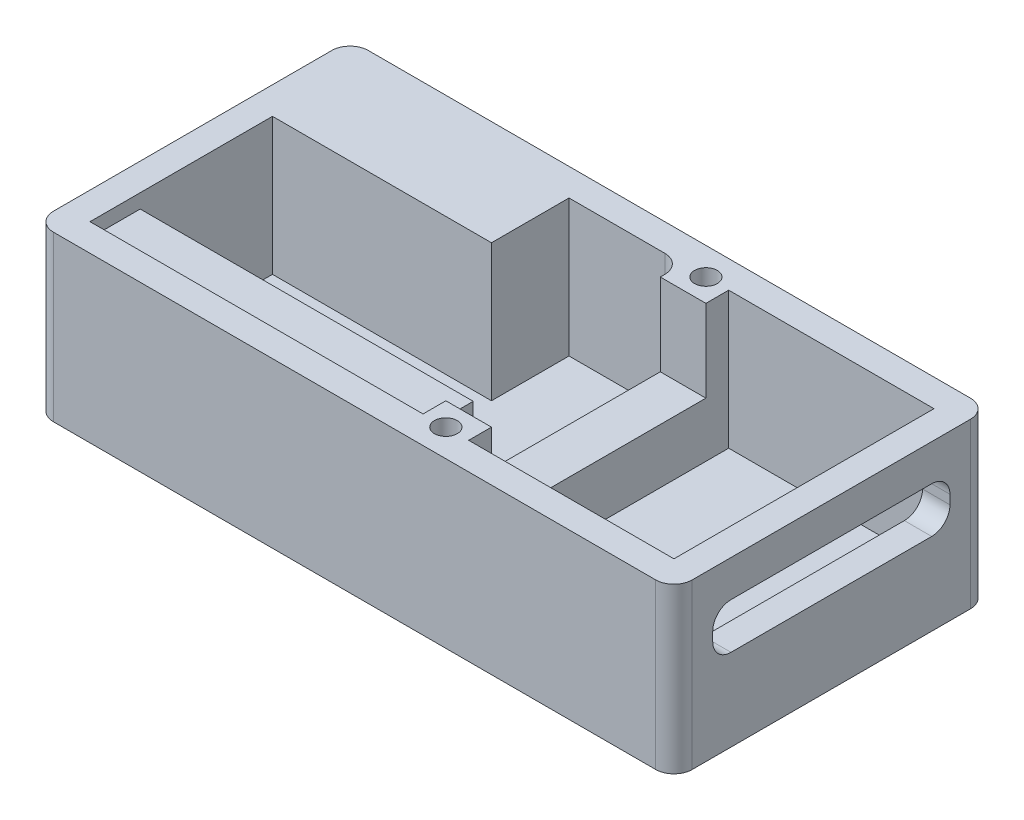
from build123d import *

# Parameters (mm, degrees)
SKETCH1_W           = 70
SKETCH1_H           = 34.5
BOSS_EXTRUDE1_DEPTH = 3
SKETCH2_W           = 70
SKETCH2_H           = 34.5
SKETCH2_W_2         = 64
SKETCH2_H_2         = 28.5
EXTRUDE_THIN1_DEPTH = 15
CUT_EXTRUDE1_REACH  = 76.307
SKETCH3_W           = 26
SKETCH3_H           = 5
SKETCH6_W           = 5
SKETCH6_H           = 28.5
BOSS_EXTRUDE2_DEPTH = 15
SKETCH7_W           = 24
SKETCH7_H           = 8.5
BOSS_EXTRUDE3_DEPTH = 15
SKETCH8_W           = 36.5
SKETCH8_H           = 5.5
BOSS_EXTRUDE4_DEPTH = 13.45
FILLET1_R           = 2
FILLET2_R           = 2
CUT_EXTRUDE6_REACH  = 44.972
SKETCH12_W          = 5
SKETCH12_H          = 23.5
SKETCH13_R          = 1.25
CUT_EXTRUDE7_DEPTH  = 10
FILLET4_R           = 2


with BuildPart() as part:
    # Sketch1 → Boss-Extrude1 (new body)
    with BuildSketch(Plane(origin=(0, 0, 0), x_dir=(1, 0, 0), z_dir=(0, 1, 0))):
        Rectangle(SKETCH1_W, SKETCH1_H)
    extrude(amount=BOSS_EXTRUDE1_DEPTH)

    # Sketch2 → Extrude-Thin1 (add)
    with BuildSketch(Plane(origin=(0, 3, 0), x_dir=(1, 0, 0), z_dir=(0, 1, 0))):
        Rectangle(SKETCH2_W, SKETCH2_H)
        Rectangle(SKETCH2_W_2, SKETCH2_H_2, mode=Mode.SUBTRACT)
    extrude(amount=EXTRUDE_THIN1_DEPTH)

    # Sketch3 → Cut-Extrude1 (cut, up to next)
    with BuildSketch(Plane(origin=(35, 0, 0), x_dir=(0, 0, -1), z_dir=(1, 0, 0)), mode=Mode.PRIVATE) as cut_extrude1_sk1:
        with Locations((0, 11.5)):
            Rectangle(SKETCH3_W, SKETCH3_H)
    cut_extrude1_tool1 = extrude(cut_extrude1_sk1.sketch, amount=-CUT_EXTRUDE1_REACH, mode=Mode.PRIVATE) & part.part
    add(cut_extrude1_tool1.solids().sort_by_distance((35, 11.5, 0))[0], mode=Mode.SUBTRACT)

    # Sketch6 → Boss-Extrude2 (add)
    with BuildSketch(Plane(origin=(0, 3, 0), x_dir=(1, 0, 0), z_dir=(0, 1, 0))):
        with Locations((7, 0)):
            Rectangle(SKETCH6_W, SKETCH6_H)
    extrude(amount=BOSS_EXTRUDE2_DEPTH)

    # Sketch7 → Boss-Extrude3 (add)
    with BuildSketch(Plane(origin=(0, 3, 0), x_dir=(1, 0, 0), z_dir=(0, 1, 0))):
        with Locations((-20, 10)):
            Rectangle(SKETCH7_W, SKETCH7_H)
    extrude(amount=BOSS_EXTRUDE3_DEPTH)

    # Sketch8 → Boss-Extrude4 (add)
    with BuildSketch(Plane(origin=(0, 3, 0), x_dir=(1, 0, 0), z_dir=(0, 1, 0))):
        with Locations((-13.75, -11.5)):
            Rectangle(SKETCH8_W, SKETCH8_H)
    extrude(amount=BOSS_EXTRUDE4_DEPTH)

    # Fillet1
    fillet1_edges = [part.edges().sort_by_distance(p)[0] for p in [
        (33.5, 9, 13),
        (33.5, 14, 13),
        (33.5, 14, -13),
        (33.5, 9, -13),
    ]]
    fillet(fillet1_edges, radius=FILLET1_R)

    # Fillet2
    fillet2_edges = [part.edges().sort_by_distance(p)[0] for p in [
        (35, 9, 17.25),
        (-35, 9, 17.25),
        (-35, 9, -17.25),
        (35, 9, -17.25),
    ]]
    fillet(fillet2_edges, radius=FILLET2_R)

    # Cut-Extrude6: up to this face of the body (flat: up to its plane)
    cut_extrude6_end = Plane(part.part.faces().sort_by_distance((33.5, 9, 0))[0])
    # Sketch12 → Cut-Extrude6 (cut, up to the picked face)
    with BuildSketch(Plane(origin=(0, 18, 0), x_dir=(1, 0, 0), z_dir=(0, 1, 0)), mode=Mode.PRIVATE) as cut_extrude6_sk1:
        with Locations((7, 0)):
            Rectangle(SKETCH12_W, SKETCH12_H)
    cut_extrude6_tool1 = split(extrude(cut_extrude6_sk1.sketch, amount=-CUT_EXTRUDE6_REACH, mode=Mode.PRIVATE), bisect_by=cut_extrude6_end, keep=Keep.BOTH, mode=Mode.PRIVATE)
    add(cut_extrude6_tool1.solids().sort_by(Axis((7, 18, 0), (0, -1, 0)))[0], mode=Mode.SUBTRACT)

    # Sketch13 → Cut-Extrude7 (cut)
    with BuildSketch(Plane(origin=(0, 18, 0), x_dir=(1, 0, 0), z_dir=(0, 1, 0))):
        with Locations(Location((7, 14.25, 0), (0, 0, 270))):
            Circle(SKETCH13_R)
        with Locations(Location((7, -14.25, 0), (0, 0, 90))):
            Circle(SKETCH13_R)
    extrude(amount=-CUT_EXTRUDE7_DEPTH, mode=Mode.SUBTRACT)

    # Fillet4
    fillet4_edges = [part.edges().sort_by_distance(p)[0] for p in [
        (4.5, 10.5, -14.25),
    ]]
    fillet(fillet4_edges, radius=FILLET4_R)


solid = part.part
